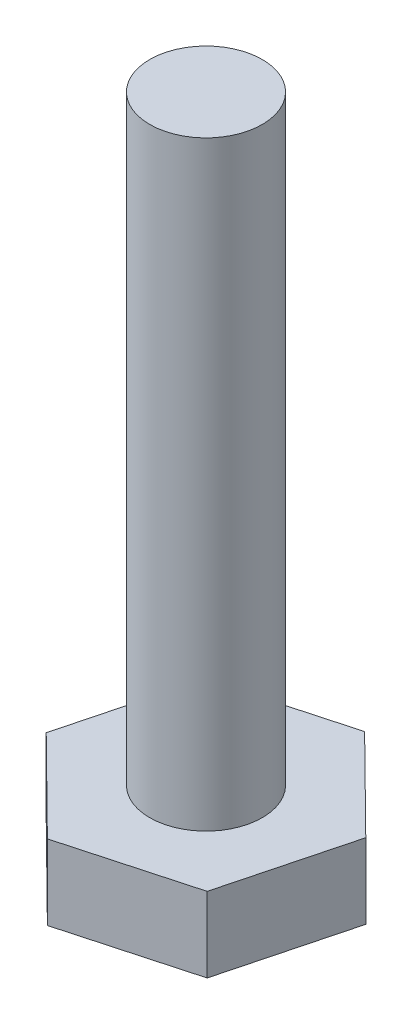
from build123d import *

# Parameters (mm, degrees)
BOSS_EXTRUDE1_DEPTH = 2
SKETCH2_R           = 1.5
BOSS_EXTRUDE2_DEPTH = 16


with BuildPart() as part:
    # Sketch1 → Boss-Extrude1 (new body)
    with BuildSketch(Plane(origin=(0, 0, 0), x_dir=(1, 0, 0), z_dir=(0, 1, 0))):
        Polygon((2.465199296, -2.433678786), (3.340227301, 0.918085822), (0.875028005, 3.351764608), (-2.465199296, 2.433678786), (-3.340227301, -0.918085822), (-0.875028005, -3.351764608), align=None)
    extrude(amount=BOSS_EXTRUDE1_DEPTH)

    # Sketch2 → Boss-Extrude2 (add)
    with BuildSketch(Plane(origin=(0, 2, 0), x_dir=(1, 0, 0), z_dir=(0, 1, 0))):
        Circle(SKETCH2_R)
    extrude(amount=BOSS_EXTRUDE2_DEPTH)


solid = part.part
